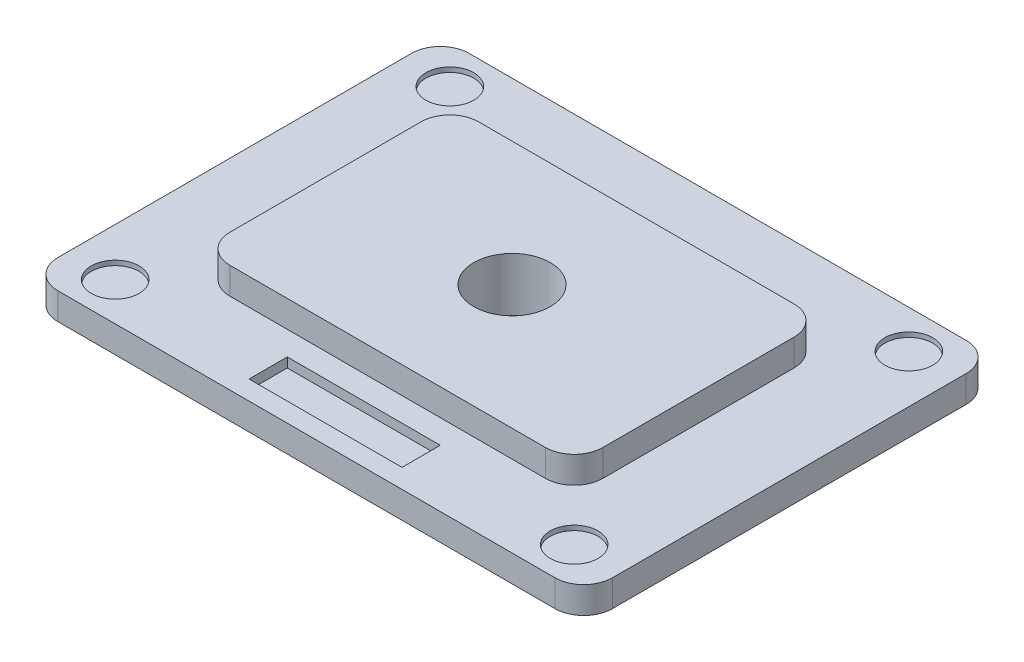
from build123d import *

# Parameters (mm, degrees)
SKETCH3_W                      = 73.66
SKETCH3_H                      = 54.61
EXTRUDED_LOWER_PLATE_DEPTH     = 3.556
SKETCH4_W                      = 49.53
SKETCH4_H                      = 33.02
EXTRUDED_UPPER_PLATE_DEPTH     = 3.556
PLATE_CORNER_FILLET_R          = 3.81
F_0_4D_HOLE_D                  = 10.16
SKETCH9_W                      = 20.32
SKETCH9_H                      = 5.08
EXTRUDED_RECTANGULAR_CUT_DEPTH = 1.27
F_4X_0_25D_PINS_D              = 6.35
F_4X_0_25D_PINS_DEPTH          = 0.635


with BuildPart() as part:
    # Sketch3 → Extruded Lower Plate (new body)
    with BuildSketch(Plane(origin=(0, 0, 0), x_dir=(1, 0, 0), z_dir=(0, 1, 0))):
        Rectangle(SKETCH3_W, SKETCH3_H)
    extrude(amount=EXTRUDED_LOWER_PLATE_DEPTH)

    # Sketch4 → Extruded Upper Plate (add)
    with BuildSketch(Plane(origin=(0, 3.556, 0), x_dir=(1, 0, 0), z_dir=(0, 1, 0))):
        Rectangle(SKETCH4_W, SKETCH4_H)
    extrude(amount=EXTRUDED_UPPER_PLATE_DEPTH)

    # Plate Corner Fillet
    plate_corner_fillet_edges = [part.edges().sort_by_distance(p)[0] for p in [
        (24.765, 5.334, -16.51),
        (-24.765, 5.334, -16.51),
        (-24.765, 5.334, 16.51),
        (24.765, 5.334, 16.51),
        (-36.83, 1.778, -27.305),
        (36.83, 1.778, -27.305),
        (36.83, 1.778, 27.305),
        (-36.83, 1.778, 27.305),
    ]]
    fillet(plate_corner_fillet_edges, radius=PLATE_CORNER_FILLET_R)

    # 0.4D Hole (through all)
    with Locations(Plane(origin=(0, 7.112, 0), x_dir=(1, 0, 0), z_dir=(0, 1, 0))):
        with Locations((0, 0)):
            Hole(F_0_4D_HOLE_D / 2)

    # Sketch9 → Extruded Rectangular Cut (cut)
    with BuildSketch(Plane(origin=(0, 3.556, 0), x_dir=(1, 0, 0), z_dir=(0, 1, 0))):
        with Locations((0, -22.225)):
            Rectangle(SKETCH9_W, SKETCH9_H)
    extrude(amount=-EXTRUDED_RECTANGULAR_CUT_DEPTH, mode=Mode.SUBTRACT)

    # 4X 0.25D Pins
    with Locations(Plane(origin=(0, 3.556, 0), x_dir=(1, 0, 0), z_dir=(0, 1, 0))):
        with Locations((-30.48, -22.225), (-30.48, 22.225), (30.48, 22.225), (30.48, -22.225)):
            Hole(F_4X_0_25D_PINS_D / 2, depth=F_4X_0_25D_PINS_DEPTH)


solid = part.part
